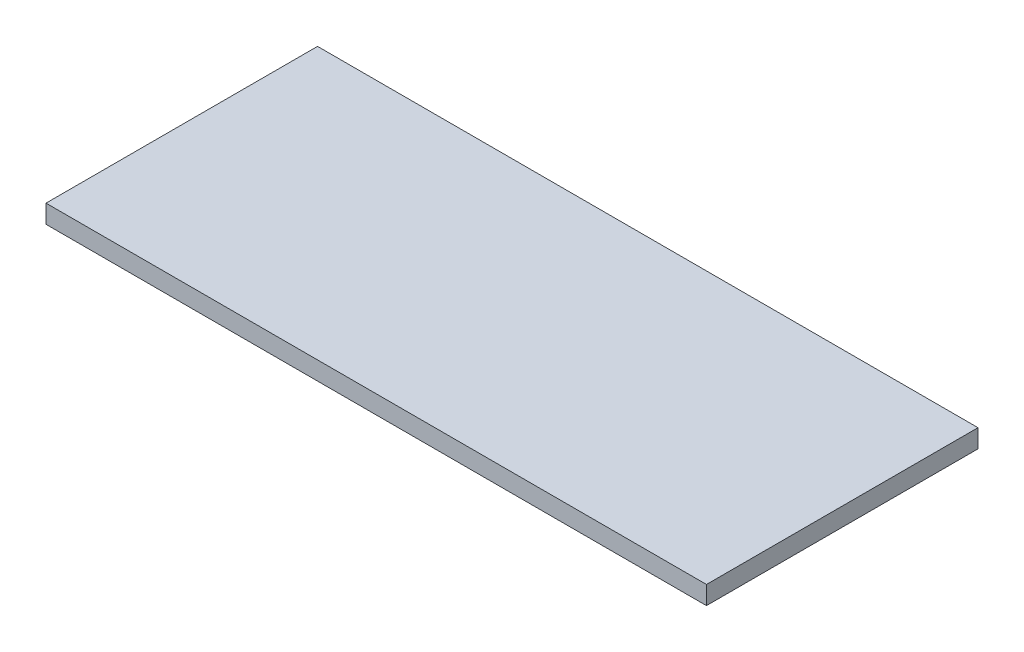
from build123d import *

# Parameters (mm, degrees)
SKETCH1_W           = 457.2
SKETCH1_H           = 187.96
BOSS_EXTRUDE1_DEPTH = 12.7


with BuildPart() as part:
    # Sketch1 → Boss-Extrude1 (new body)
    with BuildSketch(Plane(origin=(0, 0, 0), x_dir=(1, 0, 0), z_dir=(0, 1, 0))):
        Rectangle(SKETCH1_W, SKETCH1_H)
    extrude(amount=BOSS_EXTRUDE1_DEPTH)


solid = part.part
